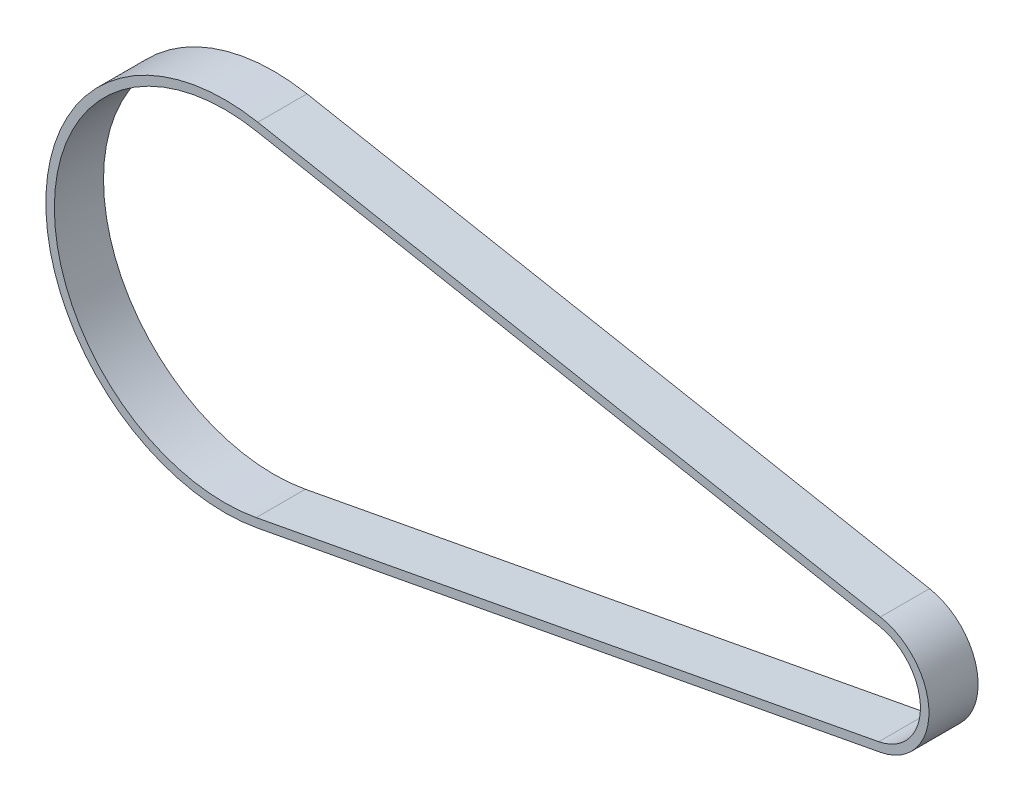
from build123d import *

# Parameters (mm, degrees)
BOSS_EXTRUDE1_DEPTH = 6.4
CUT_EXTRUDE1_DEPTH  = 95.797363492


with BuildPart() as part:
    # Sketch1 → Boss-Extrude1 (new body)
    with BuildSketch(Plane.XY):
        with BuildLine():
            Line((4.308182875, 22.882980254), (85.345752592, 7.626022193))
            ThreePointArc((85.345752592, 7.626022193), (91.67, 0), (85.345752592, -7.626022193))
            Line((85.345752592, -7.626022193), (4.308182875, -22.882980254))
            ThreePointArc((4.308182875, -22.882980254), (-23.285, 0), (4.308182875, 22.882980254))
        make_face()
    extrude(amount=BOSS_EXTRUDE1_DEPTH)

    # Sketch2 → Cut-Extrude1 (cut, through all)
    with BuildSketch(Plane.XY.offset(6.4)):
        with BuildLine():
            Line((4.102811048, 21.792144606), (85.140380765, 6.535186545))
            ThreePointArc((85.140380765, 6.535186545), (90.56, 0), (85.140380765, -6.535186545))
            Line((85.140380765, -6.535186545), (4.102811048, -21.792144606))
            ThreePointArc((4.102811048, -21.792144606), (-22.175, 0), (4.102811048, 21.792144606))
        make_face()
    extrude(amount=-CUT_EXTRUDE1_DEPTH, mode=Mode.SUBTRACT)


solid = part.part
